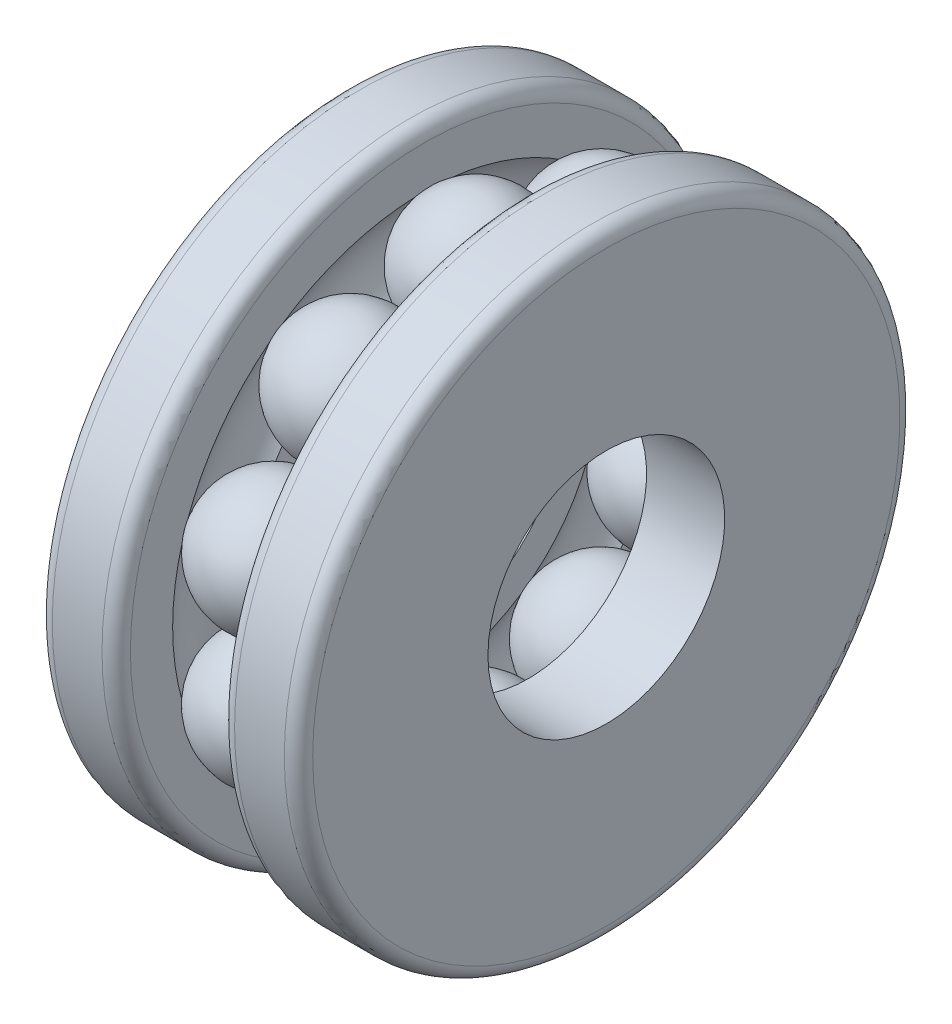
from build123d import *

# Parameters (mm, degrees)
CIRCULAR_PATTERN1_COUNT = 10
FILLET1_R               = 0.6


with BuildPart() as part:
    # Sketch1 → Revolve1 (revolve)
    with BuildSketch(Plane(origin=(0, 0, 0), x_dir=(0, 1, 0), z_dir=(0, 0, 1))):
        with BuildLine():
            Line((6.25, 0), (11.75, 0))
            ThreePointArc((11.75, 0), (9, -2.75), (6.25, 0))
        make_face()
    revolve1 = revolve(axis=Axis((0, 4.377607515, 0), (0, 1, 0)))

    # Sketch2 → Revolve2 (revolve)
    with BuildSketch(Plane(origin=(0, 0, 0), x_dir=(0, 1, 0), z_dir=(0, 0, 1)), mode=Mode.PRIVATE) as revolve2_sk:
        with BuildLine():
            Line((6, 5.5), (6, 2.2))
            Line((6, 2.2), (7.38355328, 2.2))
            ThreePointArc((7.38355328, 2.2), (9, 2.73), (10.61644672, 2.2))
            Line((10.61644672, 2.2), (13, 2.2))
            Line((13, 2.2), (13, 5.5))
            Line((13, 5.5), (6, 5.5))
        make_face()
    revolve(revolve2_sk.sketch.rotate(Axis((-4.873642073, 0, 0), (1, 0, 0)), 90), axis=Axis((-4.873642073, 0, 0), (1, 0, 0)))

    # Sketch3 → Revolve3 (revolve)
    with BuildSketch(Plane(origin=(0, 0, 0), x_dir=(0, 1, 0), z_dir=(0, 0, 1)), mode=Mode.PRIVATE) as revolve3_sk:
        with BuildLine():
            Line((5, -2.2), (7.38355328, -2.2))
            ThreePointArc((7.38355328, -2.2), (9, -2.73), (10.61644672, -2.2))
            Line((10.61644672, -2.2), (13, -2.2))
            Line((13, -2.2), (13, -5.5))
            Line((13, -5.5), (5, -5.5))
            Line((5, -5.5), (5, -2.2))
        make_face()
    revolve(revolve3_sk.sketch.rotate(Axis((-8.725907029, 0, 0), (1, 0, 0)), 90), axis=Axis((-8.725907029, 0, 0), (1, 0, 0)))

    # Circular-Pattern1: Revolve1 ×10 about axis
    circular_pattern1_axis = Axis((0, 0, 0), (1, 0, 0))
    for i in range(1, CIRCULAR_PATTERN1_COUNT):
        add(revolve1.rotate(circular_pattern1_axis, i * 360 / CIRCULAR_PATTERN1_COUNT))

    # Fillet1
    fillet1_edges = [part.edges().sort_by_distance(p)[0] for p in [
        (5.5, 0, -13),
        (2.2, 0, -13),
        (-5.5, 0, -13),
        (-2.2, 0, -13),
    ]]
    fillet(fillet1_edges, radius=FILLET1_R)


solid = part.part
